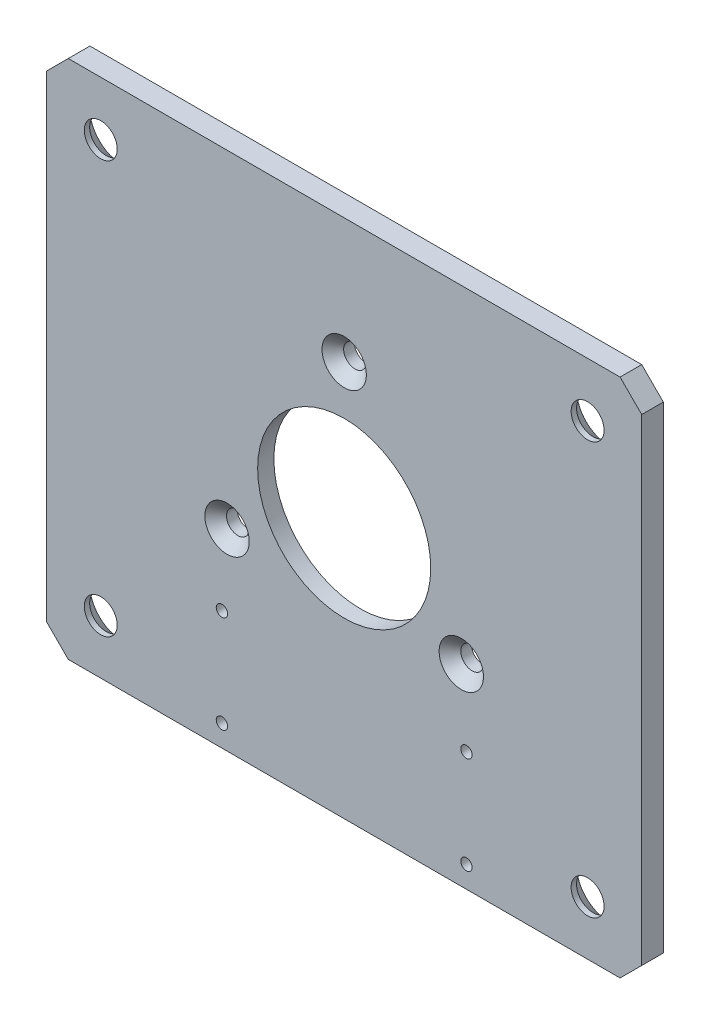
from build123d import *

# Parameters (mm, degrees)
SKETCH_1_W               = 110
SKETCH_1_H               = 96.2
SKETCH_1_R               = 3.05
SKETCH_1_R_2             = 16
EXTRUDE_1_DEPTH          = 2
CHAMFER_1_SIZE           = 4
CHAMFER_2_SIZE           = 3
SKETCH_2_R               = 17.5
CUT_EXTRUDE_1_DEPTH      = 1
SKETCH_3_R               = 2.1
CUT_EXTRUDE_2_DEPTH      = 74.175200717
PATTERN_CIRCULAR_1_COUNT = 3
CHAMFER_3_SIZE           = 2
SKETCH_4_R               = 1.05
CUT_EXTRUDE_3_DEPTH      = 74.175200717


with BuildPart() as part:
    # 草图1 → 凸台-拉伸1 (new, symmetric)
    with BuildSketch(Plane.XY):
        Rectangle(SKETCH_1_W, SKETCH_1_H)
        with Locations((-45, 38.1)):
            Circle(SKETCH_1_R, mode=Mode.SUBTRACT)
        with Locations((-45, -38.1)):
            Circle(SKETCH_1_R, mode=Mode.SUBTRACT)
        with Locations((45, -38.1)):
            Circle(SKETCH_1_R, mode=Mode.SUBTRACT)
        with Locations((45, 38.1)):
            Circle(SKETCH_1_R, mode=Mode.SUBTRACT)
        Circle(SKETCH_1_R_2, mode=Mode.SUBTRACT)
    extrude(amount=EXTRUDE_1_DEPTH, both=True)

    # 倒角1
    chamfer_1_edges = [part.edges().sort_by_distance(p)[0] for p in [
        (-55, 48.1, 0),
        (55, 48.1, 0),
        (55, -48.1, 0),
        (-55, -48.1, 0),
    ]]
    chamfer(chamfer_1_edges, length=CHAMFER_1_SIZE)

    # 倒角2
    chamfer_2_edges = [part.edges().sort_by_distance(p)[0] for p in [
        (-48.05, 38.1, -2),
        (-48.05, -38.1, -2),
        (41.95, -38.1, -2),
        (41.95, 38.1, -2),
    ]]
    chamfer(chamfer_2_edges, length=CHAMFER_2_SIZE)

    # 草图2 → 切除-拉伸1 (cut)
    with BuildSketch(Plane(origin=(0, 0, -2), x_dir=(-1, 0, 0), z_dir=(0, 0, -1))):
        Circle(SKETCH_2_R)
    extrude(amount=-CUT_EXTRUDE_1_DEPTH, mode=Mode.SUBTRACT)

    # 草图3 → 切除-拉伸2 (cut, through all)
    with BuildSketch(Plane(origin=(0, 0, -2), x_dir=(-1, 0, 0), z_dir=(0, 0, -1))):
        with Locations((0, 25)):
            Circle(SKETCH_3_R)
    cut_extrude_2 = extrude(amount=-CUT_EXTRUDE_2_DEPTH, mode=Mode.SUBTRACT)

    # 阵列(圆周)1: 切除-拉伸2 ×3 about axis
    pattern_circular_1_axis = Axis((0, 0, 0), (0, 0, 1))
    for i in range(1, PATTERN_CIRCULAR_1_COUNT):
        add(cut_extrude_2.rotate(pattern_circular_1_axis, i * 360 / PATTERN_CIRCULAR_1_COUNT), mode=Mode.SUBTRACT)

    # 倒角3
    chamfer_3_edges = [part.edges().sort_by_distance(p)[0] for p in [
        (2.1, 25, 2),
        (-22.700635095, -10.681346652, 2),
        (20.600635095, -14.318653348, 2),
    ]]
    chamfer(chamfer_3_edges, length=CHAMFER_3_SIZE)

    # 草图4 → 切除-拉伸3 (cut, through all)
    with BuildSketch(Plane(origin=(0, 0, -2), x_dir=(-1, 0, 0), z_dir=(0, 0, -1))):
        with Locations((-22.6, -26.1)):
            Circle(SKETCH_4_R)
        with Locations((-22.6, -44.1)):
            Circle(SKETCH_4_R)
        with Locations((22.6, -26.1)):
            Circle(SKETCH_4_R)
        with Locations((22.6, -44.1)):
            Circle(SKETCH_4_R)
    extrude(amount=-CUT_EXTRUDE_3_DEPTH, mode=Mode.SUBTRACT)


solid = part.part
